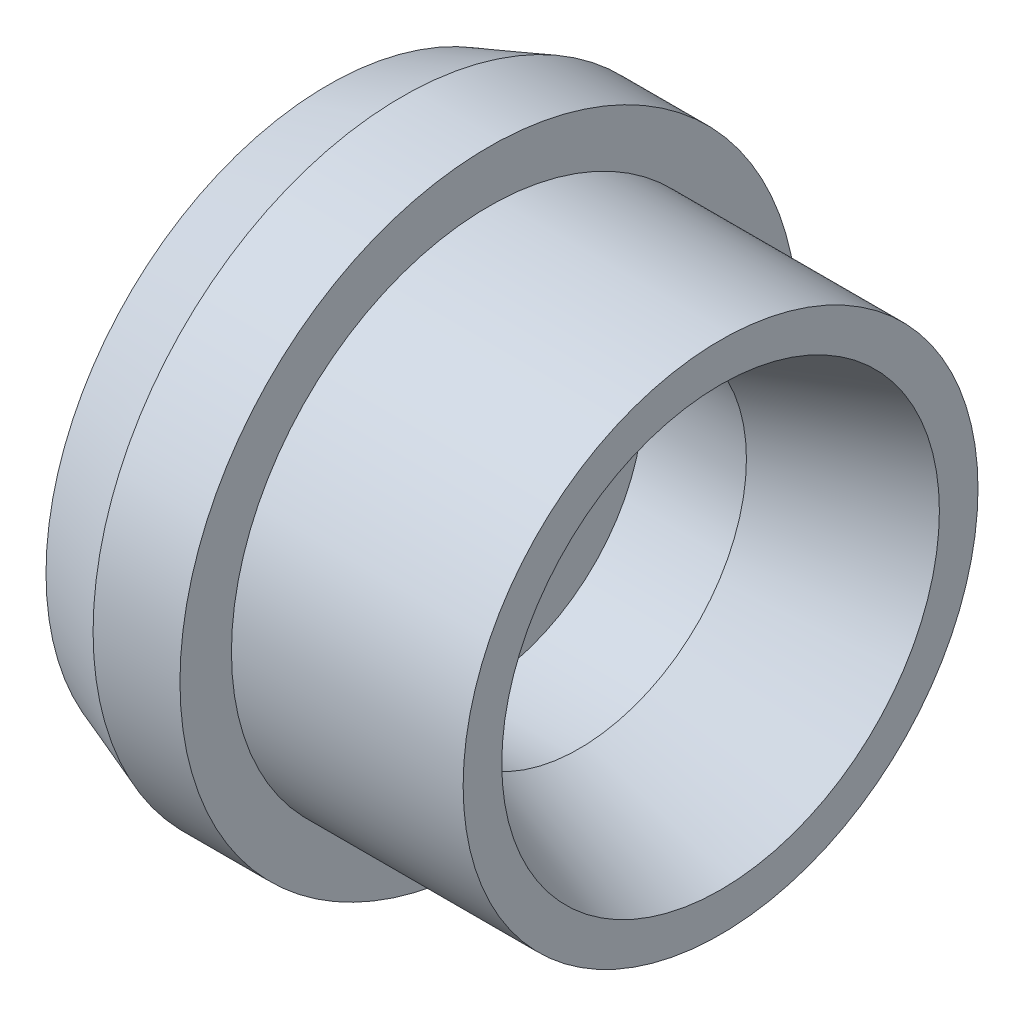
from build123d import *


with BuildPart() as part:
    # Sketch1 → Revolve1 (revolve)
    with BuildSketch(Plane.XY, mode=Mode.PRIVATE) as revolve1_sk:
        Polygon((0, 0), (0, 5.564421473), (1.4605, 6.096), (3.175, 6.096), (3.175, 5.08), (7.747, 5.08), (7.747, 4.318), (4.955562942, 3.302), (2.921, 3.302), (2.921, 0), align=None)
    revolve(revolve1_sk.sketch.rotate(Axis((2.921, 0, 0), (-1, 0, 0)), 90), axis=Axis((2.921, 0, 0), (-1, 0, 0)))


solid = part.part
